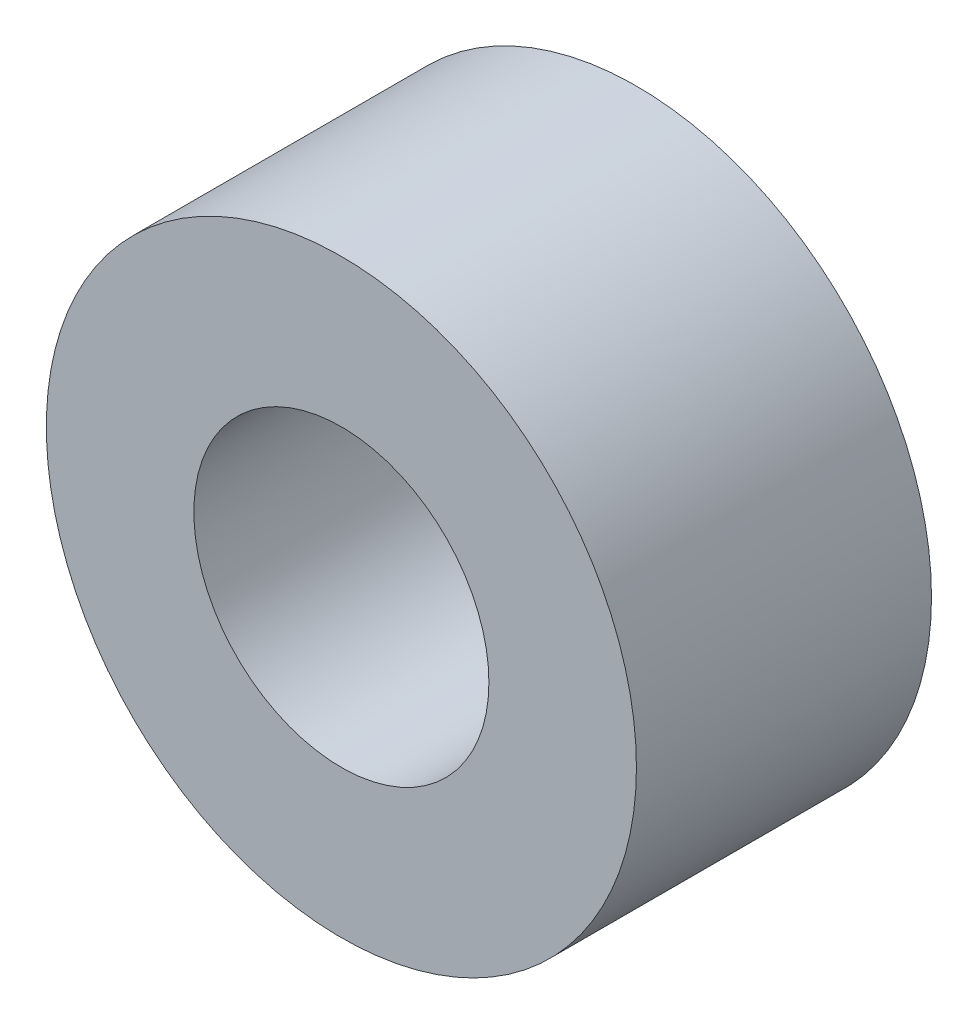
from build123d import *

# Parameters (mm, degrees)
SKETCH_1_R      = 5
SKETCH_1_R_2    = 2.5
EXTRUDE_1_DEPTH = 5


with BuildPart() as part:
    # 草图1 → 凸台-拉伸1 (new body)
    with BuildSketch(Plane.XY):
        with Locations((-18.689914132, 1.12872102)):
            Circle(SKETCH_1_R)
        with Locations((-18.689914132, 1.12872102)):
            Circle(SKETCH_1_R_2, mode=Mode.SUBTRACT)
    extrude(amount=EXTRUDE_1_DEPTH)


solid = part.part
